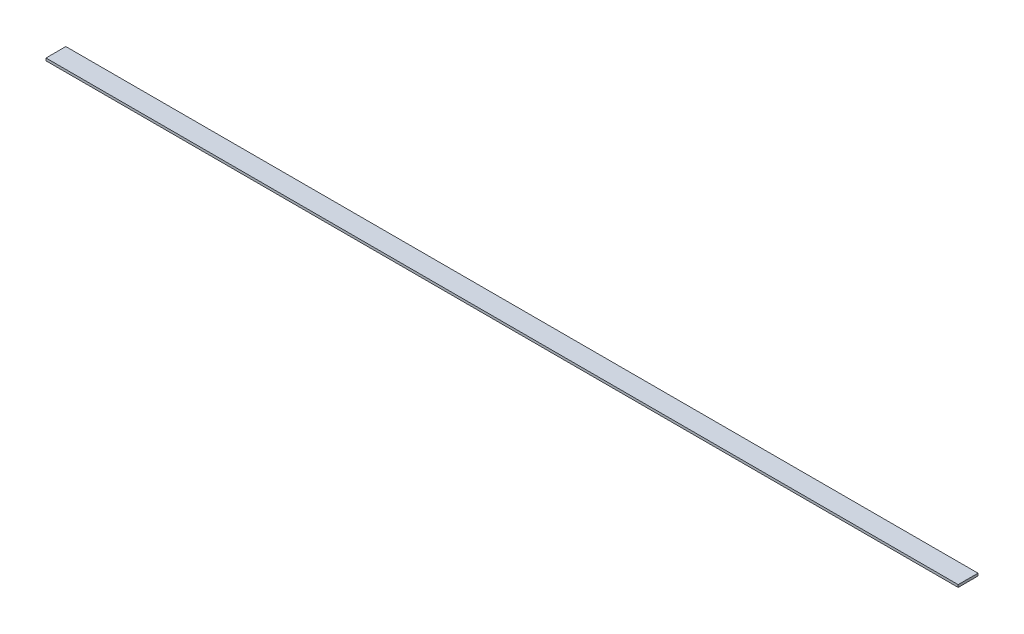
from build123d import *

# Parameters (mm, degrees)
SKETCH1_W           = 1168.4
SKETCH1_H           = 25.4
BOSS_EXTRUDE1_DEPTH = 3.175


with BuildPart() as part:
    # Sketch1 → Boss-Extrude1 (new body)
    with BuildSketch(Plane(origin=(0, 0, 0), x_dir=(1, 0, 0), z_dir=(0, 1, 0))):
        Rectangle(SKETCH1_W, SKETCH1_H)
    extrude(amount=BOSS_EXTRUDE1_DEPTH)


solid = part.part
